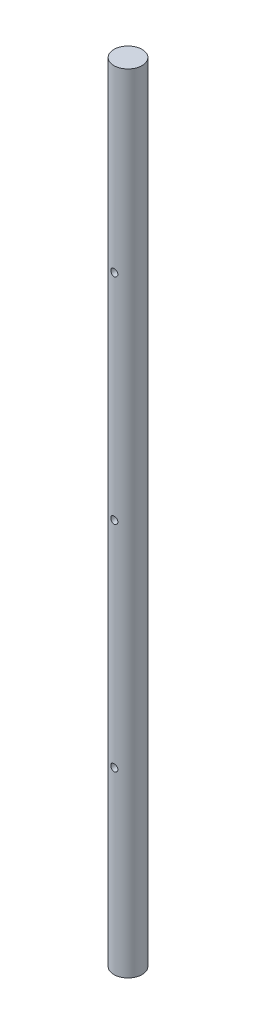
from build123d import *

# Parameters (mm, degrees)
ESQUISSE1_R             = 5
BOSS_EXTRU_1_DEPTH      = 280
CUT_EXTRUDE1_DEPTH      = 10
CUT_EXTRUDE1_DEPTH_BACK = 10
SKETCH1_R               = 1.25


with BuildPart() as part:
    # Esquisse1 → Boss.-Extru.1 (new body)
    with BuildSketch(Plane(origin=(0, 0, 0), x_dir=(1, 0, 0), z_dir=(0, 1, 0))):
        Circle(ESQUISSE1_R)
    extrude(amount=BOSS_EXTRU_1_DEPTH)

    # Sketch1 → Cut-Extrude1 (cut, two sides: drawn at the far end of the back side and taken through both)
    with BuildSketch(Plane.XY.offset(-CUT_EXTRUDE1_DEPTH_BACK)):
        with Locations((0, 216.25)):
            Circle(SKETCH1_R)
        with Locations((0, 140)):
            Circle(SKETCH1_R)
        with Locations((0, 63.75)):
            Circle(SKETCH1_R)
    extrude(amount=CUT_EXTRUDE1_DEPTH + CUT_EXTRUDE1_DEPTH_BACK, mode=Mode.SUBTRACT)


solid = part.part
